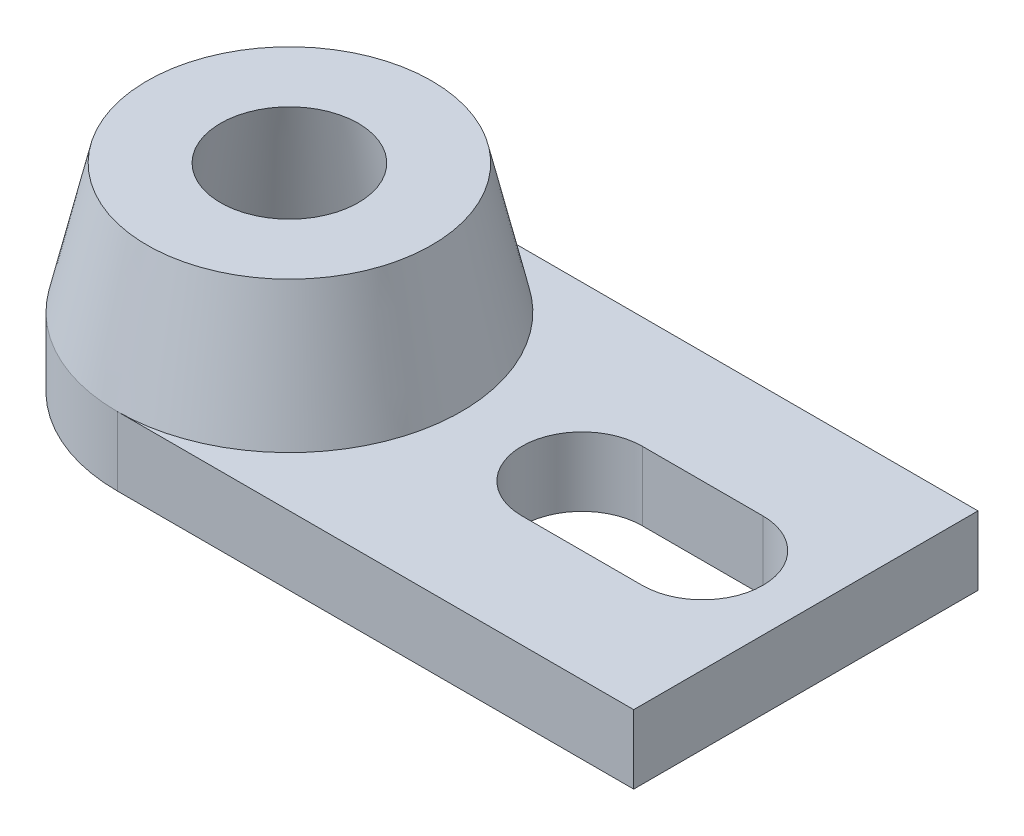
from build123d import *

# Parameters (mm, degrees)
SALIENTE_EXTRUIR1_START = -8
SALIENTE_EXTRUIR1_DEPTH = 8


with BuildPart() as part:
    # Croquis1 → Revolución3 (revolve)
    with BuildSketch(Plane.XY, mode=Mode.PRIVATE) as revoluci_n3_sk:
        Polygon((12.055520556, 0), (20, 0), (20, 8), (16.536977133, 23), (8, 23), align=None)
    revolve(revoluci_n3_sk.sketch.rotate(Axis((0, 0, 0), (0, 1, 0)), 90), axis=Axis((0, 0, 0), (0, 1, 0)))

    # Croquis2 → Saliente-Extruir1 (add)
    with BuildSketch(Plane(origin=(0, 0, 0), x_dir=(-1, 0, 0), z_dir=(0, -1, 0)).offset(SALIENTE_EXTRUIR1_START)):
        with BuildLine():
            Line((0, 20), (-60, 20))
            Line((-60, 20), (-60, -20))
            Line((-60, -20), (0, -20))
            ThreePointArc((0, -20), (-20, 0), (0, 20))
        make_face()
        with BuildLine():
            Line((-34, 7), (-48, 7))
            ThreePointArc((-48, 7), (-55, 0), (-48, -7))
            Line((-48, -7), (-34, -7))
            ThreePointArc((-34, -7), (-27, 0), (-34, 7))
        make_face(mode=Mode.SUBTRACT)
    extrude(amount=SALIENTE_EXTRUIR1_DEPTH)


solid = part.part
